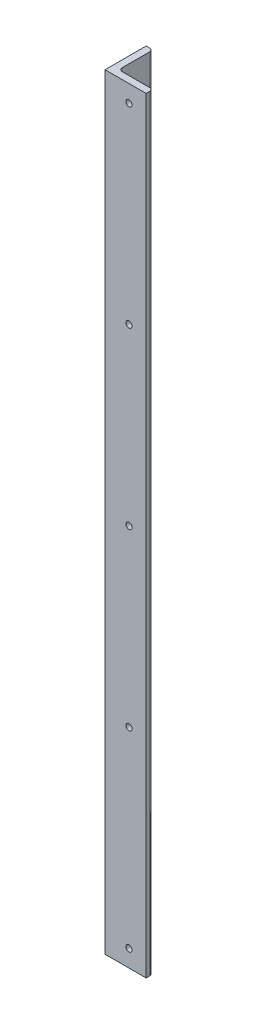
from build123d import *

# Parameters (mm, degrees)
BOSS_EXTRUDE1_DEPTH = 355.6
SKETCH3_R           = 1.4224
CUT_EXTRUDE1_DEPTH  = 5.08


with BuildPart() as part:
    # Sketch2 → Boss-Extrude1 (new body)
    with BuildSketch(Plane(origin=(0, 0, 0), x_dir=(1, 0, 0), z_dir=(0, 1, 0))):
        with BuildLine():
            Line((0, 0), (19.05, 0))
            Line((19.05, 0), (19.05, 1.5875))
            ThreePointArc((19.05, 1.5875), (18.585032015, 2.710032015), (17.4625, 3.175))
            Line((17.4625, 3.175), (4.7625, 3.175))
            ThreePointArc((4.7625, 3.175), (3.639967985, 3.639967985), (3.175, 4.7625))
            Line((3.175, 4.7625), (3.175, 17.4625))
            ThreePointArc((3.175, 17.4625), (2.710032015, 18.585032015), (1.5875, 19.05))
            Line((1.5875, 19.05), (0, 19.05))
            Line((0, 19.05), (0, 0))
        make_face()
    extrude(amount=BOSS_EXTRUDE1_DEPTH)

    # Sketch3 → Cut-Extrude1 (cut)
    with BuildSketch(Plane(origin=(0, 0, -3.175), x_dir=(-1, 0, 0), z_dir=(0, 0, -1))):
        with Locations((-11.1125, 7.9375)):
            Circle(SKETCH3_R)
        with Locations((-11.1125, 347.6625)):
            Circle(SKETCH3_R)
        with Locations((-11.1125, 96.8375)):
            Circle(SKETCH3_R)
        with Locations((-11.1125, 177.8)):
            Circle(SKETCH3_R)
        with Locations((-11.1125, 258.7625)):
            Circle(SKETCH3_R)
    extrude(amount=-CUT_EXTRUDE1_DEPTH, mode=Mode.SUBTRACT)


solid = part.part
